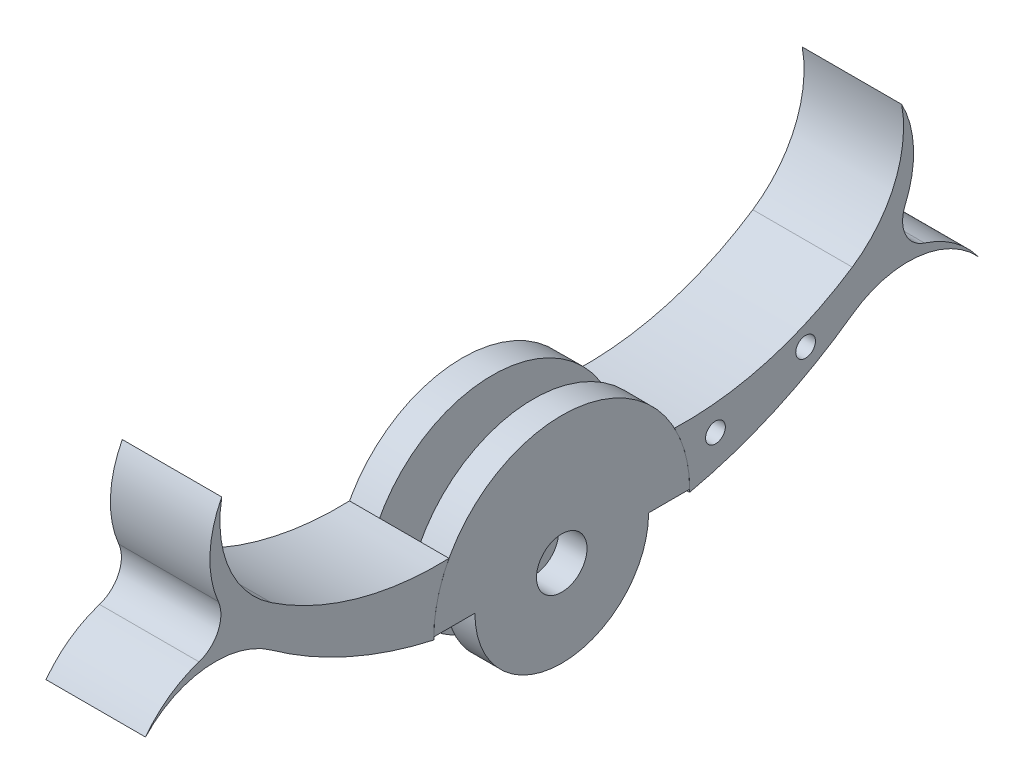
from build123d import *

# Parameters (mm, degrees)
SKETCH1_R                               = 10.287
BOSS_EXTRUDE1_DEPTH                     = 8.001
SKETCH2_R                               = 2.032
CUT_EXTRUDE1_DEPTH                      = 3.7338
CUT_EXTRUDE2_START                      = -3.7338
SKETCH3_R                               = 2.032
CUT_EXTRUDE2_DEPTH                      = 3.7338
BOSS_EXTRUDE2_DEPTH                     = 8.001
CUT_EXTRUDE3_START                      = -8.001
CUT_EXTRUDE3_DEPTH                      = 8.001
SKETCH6_W                               = 3.302
SKETCH6_H                               = 19.9136
CUT_EXTRUDE4_DEPTH                      = 39.509209906
F_1_16_0_0625_DIAMETER_HOLE1_AT_2_COUNT = 2
F_1_16_0_0625_DIAMETER_HOLE1_AT_2_PITCH = 7.62


with BuildPart() as part:
    # Sketch1 → Boss-Extrude1 (new body)
    with BuildSketch(Plane(origin=(0, 0, 0), x_dir=(0, 0, -1), z_dir=(1, 0, 0))):
        Circle(SKETCH1_R)
    extrude(amount=BOSS_EXTRUDE1_DEPTH)

    # Sketch2 → Cut-Extrude1 (cut)
    with BuildSketch(Plane(origin=(8.001, 0, 0), x_dir=(0, 0, -1), z_dir=(1, 0, 0))):
        Circle(SKETCH2_R)
    extrude(amount=-CUT_EXTRUDE1_DEPTH, mode=Mode.SUBTRACT)

    # Sketch3 → Cut-Extrude2 (cut)
    with BuildSketch(Plane.ZY.offset(CUT_EXTRUDE2_START)):
        with Locations(Location((0, 0, 0), (0, 0, 180))):
            Circle(SKETCH3_R)
    extrude(amount=CUT_EXTRUDE2_DEPTH, mode=Mode.SUBTRACT)

    # Sketch5 → Cut-Extrude3 (cut)
    with BuildSketch(Plane(origin=(8.001, 0, 0), x_dir=(0, 0, -1), z_dir=(1, 0, 0)).offset(CUT_EXTRUDE3_START)):
        with BuildLine():
            Line((-6.985, 0), (-10.287, 0))
            ThreePointArc((-10.287, 0), (0, -10.287), (10.287, 0))
            Line((10.287, 0), (6.985, 0))
            ThreePointArc((6.985, 0), (0, -6.985), (-6.985, 0))
        make_face()
    extrude(amount=CUT_EXTRUDE3_DEPTH, mode=Mode.SUBTRACT)

    # Sketch6 → Cut-Extrude4 (cut, through all)
    with BuildSketch(Plane(origin=(0, 10.287, 0), x_dir=(1, 0, 0), z_dir=(0, 1, 0))):
        with Locations((4.064, 0)):
            Rectangle(SKETCH6_W, SKETCH6_H)
    extrude(amount=-CUT_EXTRUDE4_DEPTH, mode=Mode.SUBTRACT)


with BuildPart() as body_2:
    # Sketch4 → Boss-Extrude2 (new body)
    with BuildSketch(Plane.ZY):
        with BuildLine():
            ThreePointArc((9.066535783, 4.860071799), (10.003433712, 2.398683591), (10.284648783, -0.219928201))
            ThreePointArc((10.284648783, -0.219928201), (17.121583704, 2.037315344), (23.365648783, 5.622071799))
            ThreePointArc((23.365648783, 5.622071799), (28.610506662, 7.025976389), (33.475681659, 4.615674643))
            ThreePointArc((33.475681659, 4.615674643), (31.564768671, 6.496206487), (29.171267322, 7.704155061))
            ThreePointArc((29.171267322, 7.704155061), (27.638389928, 9.072717296), (27.619726913, 11.127547555))
            ThreePointArc((27.619726913, 11.127547555), (28.291483716, 14.73214833), (27.341838119, 18.273698442))
            ThreePointArc((27.341838119, 18.273698442), (26.750112425, 13.005040292), (23.365648783, 8.924071799))
            ThreePointArc((23.365648783, 8.924071799), (16.53490074, 5.770349813), (9.066535783, 4.860071799))
        make_face()
    extrude(amount=-BOSS_EXTRUDE2_DEPTH)


with BuildPart() as body_3:
    # Mirror3: mirrored copy
    add(body_2.part.mirror(Plane.XY))

    # Sketch9 → 1/16 (0.0625) Diameter Hole1 (revolve, cut)
    with BuildSketch(Plane(origin=(0, 2.909568803, -12.362217009), x_dir=(0, 0, 1), z_dir=(0, 1, 0))):
        Polygon((0, 0), (0, 70.580933116), (0.79375, 70.104), (0.79375, 0), align=None)
    f_1_16_0_0625_diameter_hole1 = revolve(axis=Axis((-6.35, 2.909568803, -12.362217009), (1, 0, 0)), mode=Mode.SUBTRACT)

    # 1/16 (0.0625) Diameter Hole1 at 2: 1/16 (0.0625) Diameter Hole1 ×2
    with Locations(*[Vector(0, 0.30816938901422175, -0.9513315025135041) * (i * F_1_16_0_0625_DIAMETER_HOLE1_AT_2_PITCH) for i in range(1, F_1_16_0_0625_DIAMETER_HOLE1_AT_2_COUNT)]):
        add(f_1_16_0_0625_diameter_hole1, mode=Mode.SUBTRACT)


solid = Compound([part.part, body_2.part, body_3.part])
